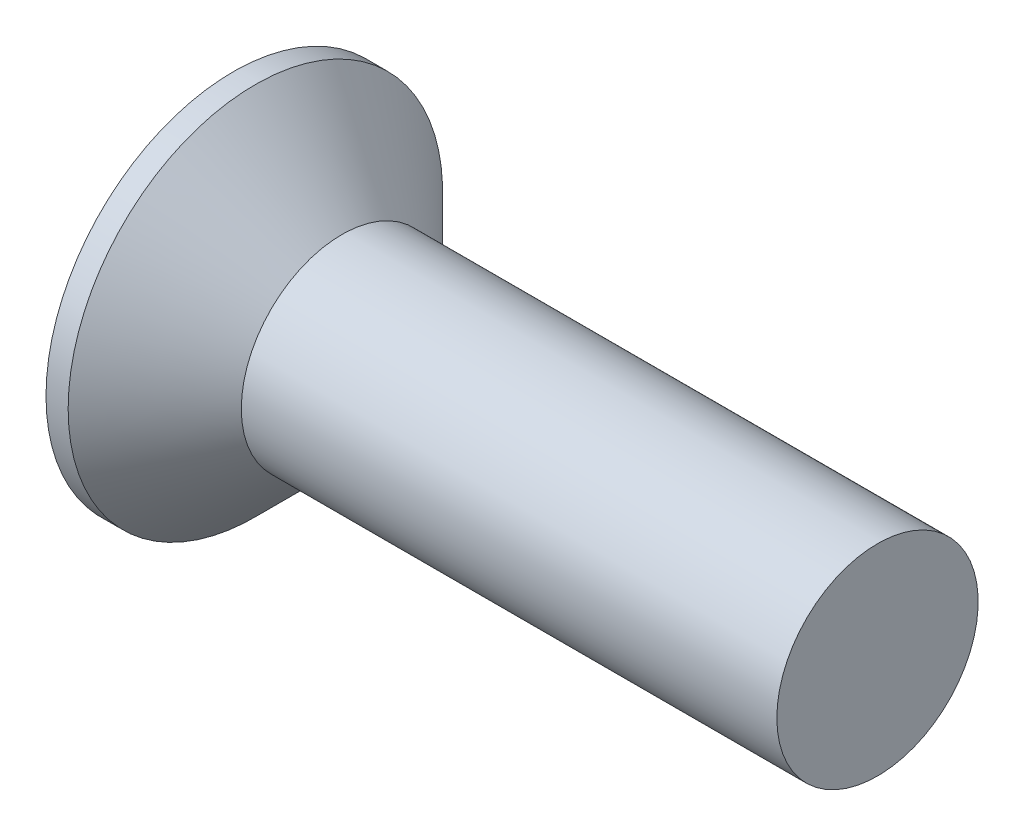
from build123d import *


with BuildPart() as part:
    # Esquisse1 → Révolution1 (revolve)
    with BuildSketch(Plane.XY, mode=Mode.PRIVATE) as r_volution1_sk:
        Polygon((0, 0), (16, 0), (16, 2.5), (2.7, 2.5), (0.55, 4.65), (0, 4.65), align=None)
    revolve(r_volution1_sk.sketch.rotate(Axis((0, 0, 0), (1, 0, 0)), 90), axis=Axis((0, 0, 0), (1, 0, 0)))


solid = part.part
